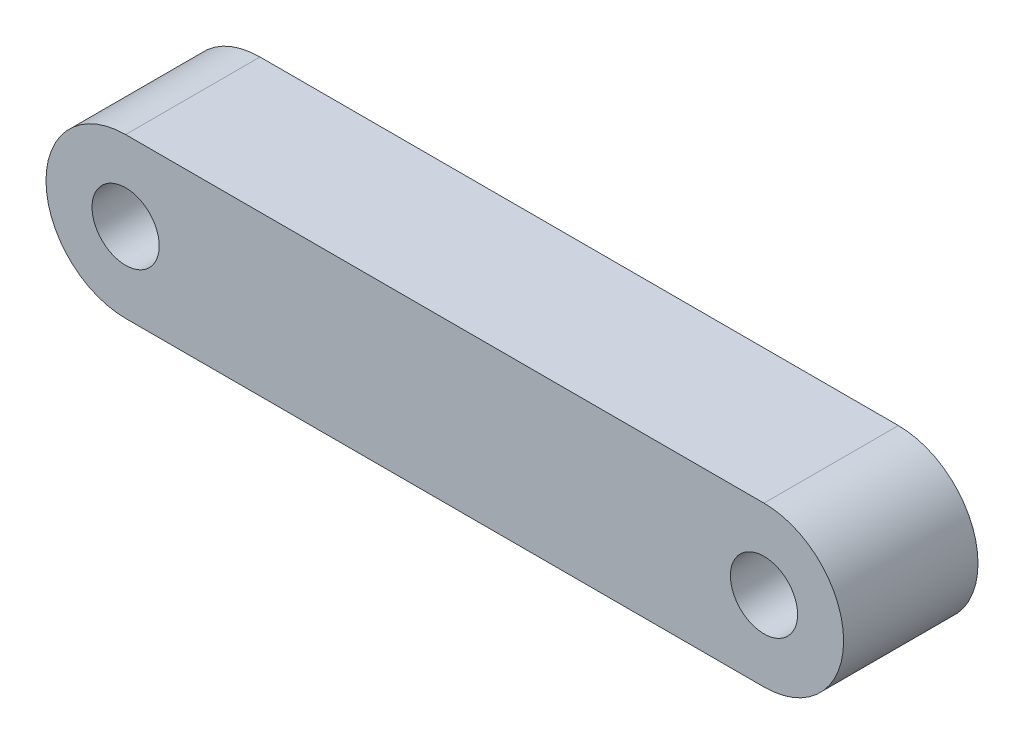
from build123d import *

# Parameters (mm, degrees)
SKETCH1_R           = 1
BOSS_EXTRUDE1_DEPTH = 4


with BuildPart() as part:
    # Sketch1 → Boss-Extrude1 (new body)
    with BuildSketch(Plane.XY):
        with BuildLine():
            Line((-9.073469388, 2.37), (9.926530612, 2.37))
            ThreePointArc((9.926530612, 2.37), (12.296530612, 0), (9.926530612, -2.37))
            Line((9.926530612, -2.37), (-9.073469388, -2.37))
            ThreePointArc((-9.073469388, -2.37), (-11.443469388, 0), (-9.073469388, 2.37))
        make_face()
        with Locations((9.926530612, 0)):
            Circle(SKETCH1_R, mode=Mode.SUBTRACT)
        with Locations((-9.073469388, 0)):
            Circle(SKETCH1_R, mode=Mode.SUBTRACT)
    extrude(amount=BOSS_EXTRUDE1_DEPTH)


solid = part.part
